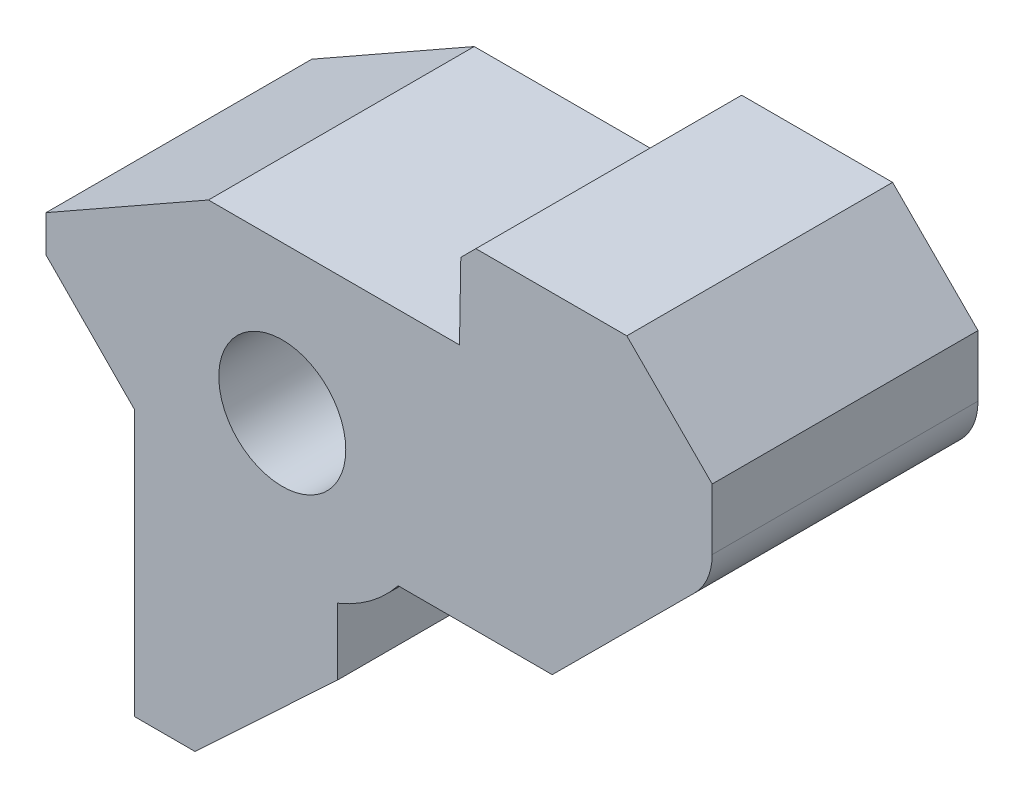
from build123d import *

# Parameters (mm, degrees)
SKETCH_1_R      = 2.15
EXTRUDE_1_DEPTH = 4.5
FILLET_1_R      = 2
CHAMFER_1_SIZE  = 0.5
CHAMFER_1_SIZE2 = 0.508960096


with BuildPart() as part:
    # 스케치1 → 보스-돌출1 (new, symmetric)
    with BuildSketch(Plane.XY):
        with BuildLine():
            Line((-8, 0.638251315), (-5, -2.4))
            Line((-5, -2.4), (-5, -11.4))
            Line((-5, -11.4), (-2.956819065, -11.4))
            Line((-2.956819065, -11.4), (1.87605446, -6.887535593))
            Line((1.87605446, -6.887535593), (1.87605446, -4.634697365))
            ThreePointArc((1.87605446, -4.634697365), (2.999351329, -4.000486421), (3.923009049, -3.1))
            Line((3.923009049, -3.1), (9.140101739, -3.1))
            Line((9.140101739, -3.1), (14.557074242, 2.3))
            Line((14.557074242, 2.3), (14.557074242, 5.2))
            Line((14.557074242, 5.2), (11.666160546, 8.1))
            Line((11.666160546, 8.1), (6.054110701, 8.1))
            Line((6.054110701, 8.1), (6, 5))
            Line((6, 5), (-2.5, 5))
            Line((-2.5, 5), (-8, 1.878902403))
            Line((-8, 1.878902403), (-8, 0.638251315))
        make_face()
        Circle(SKETCH_1_R, mode=Mode.SUBTRACT)
    extrude(amount=EXTRUDE_1_DEPTH, both=True)

    # 필렛1
    fillet_1_edges = [part.edges().sort_by_distance(p)[0] for p in [
        (14.557074242, 2.3, 0),
    ]]
    fillet(fillet_1_edges, radius=FILLET_1_R)

    # 모따기1
    chamfer_1_edges = [part.edges().sort_by_distance(p)[0] for p in [
        (6.054110701, 8.1, 0),
    ]]
    chamfer_1_side = [part.faces().sort_by_distance(p)[0] for p in [
        (8.860135624, 8.1, 0),
    ]]
    chamfer(chamfer_1_edges, length=CHAMFER_1_SIZE, length2=CHAMFER_1_SIZE2, reference=chamfer_1_side[0])


solid = part.part
